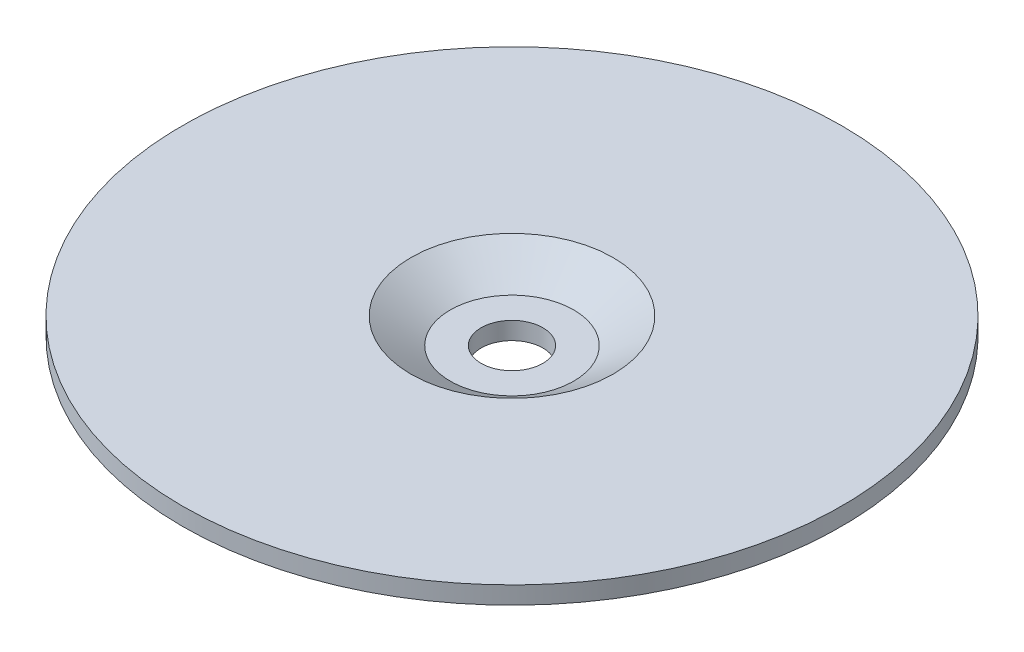
from build123d import *


with BuildPart() as part:
    # Sketch1 → Revolve1 (revolve)
    with BuildSketch(Plane.XY, mode=Mode.PRIVATE) as revolve1_sk:
        Polygon((-3.5687, 0), (-3.5687, 2.032), (-7.1374, 2.032), (-11.684, 5.0038), (-38.1, 5.0038), (-38.1, 2.9718), (-11.684, 2.9718), (-7.1374, 0), align=None)
    revolve(revolve1_sk.sketch.rotate(Axis((0, 0, 0), (0, 1, 0)), 270), axis=Axis((0, 0, 0), (0, 1, 0)))


solid = part.part
